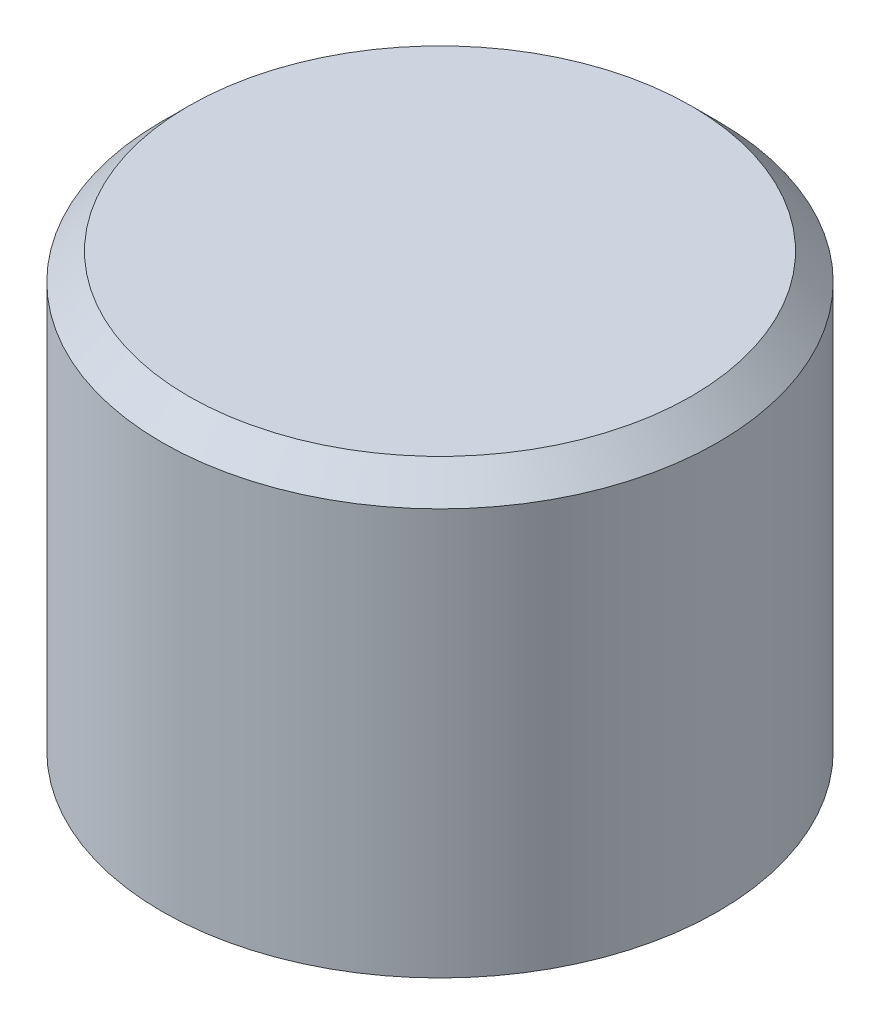
from build123d import *

# Parameters (mm, degrees)
CHAMFER_1_SIZE = 0.8


with BuildPart() as part:
    # Эскиз1 → Повернуть1 (revolve)
    with BuildSketch(Plane.XY, mode=Mode.PRIVATE) as revolve_1_sk:
        Polygon((0, 0), (-8.35, 0), (-8.35, -13), (-7.5, -13), (-7.5, -10.7), (-2.5, -10.7), (-2.5, -3), (0, -3), align=None)
    revolve(revolve_1_sk.sketch.rotate(Axis((0, -3, 0), (0, 1, 0)), 270), axis=Axis((0, -3, 0), (0, 1, 0)))

    # Фаска1
    chamfer_1_edges = [part.edges().sort_by_distance(p)[0] for p in [
        (0, 0, 8.35),
    ]]
    chamfer(chamfer_1_edges, length=CHAMFER_1_SIZE)


solid = part.part
